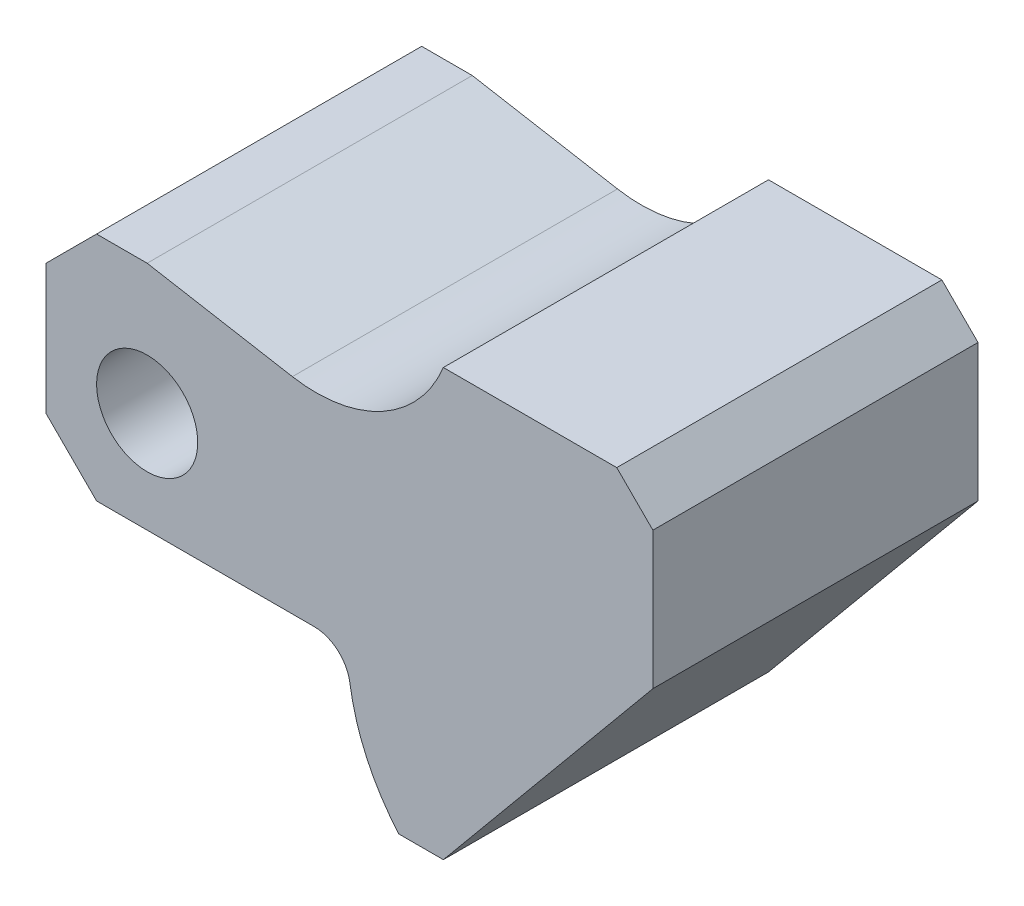
from build123d import *

# Parameters (mm, degrees)
SKETCH1_R           = 7
BOSS_EXTRUDE1_DEPTH = 22.5


with BuildPart() as part:
    # Sketch1 → Boss-Extrude1 (new, symmetric)
    with BuildSketch(Plane.XY):
        with BuildLine():
            Line((0, 0), (-7, 7))
            Line((-7, 7), (-7, 25))
            Line((-7, 25), (0, 32))
            Line((0, 32), (7, 32))
            Line((7, 32), (27.104042352, 28.455114912))
            ThreePointArc((27.104042352, 28.455114912), (39.591637328, 30.535902458), (48, 40))
            Line((48, 40), (72, 40))
            Line((72, 40), (77, 35))
            Line((77, 35), (77, 16))
            Line((77, 16), (48, -19))
            Line((48, -19), (41.833954843, -19))
            ThreePointArc((41.833954843, -19), (37.394982646, -12.115672061), (35.058152443, -4.264705882))
            ThreePointArc((35.058152443, -4.264705882), (33.377749482, -1.213413768), (30.112513701, 0))
            Line((30.112513701, 0), (0, 0))
        make_face()
        with Locations(Location((7, 14, 0), (0, 0, 180))):
            Circle(SKETCH1_R, mode=Mode.SUBTRACT)
    extrude(amount=BOSS_EXTRUDE1_DEPTH, both=True)


solid = part.part
